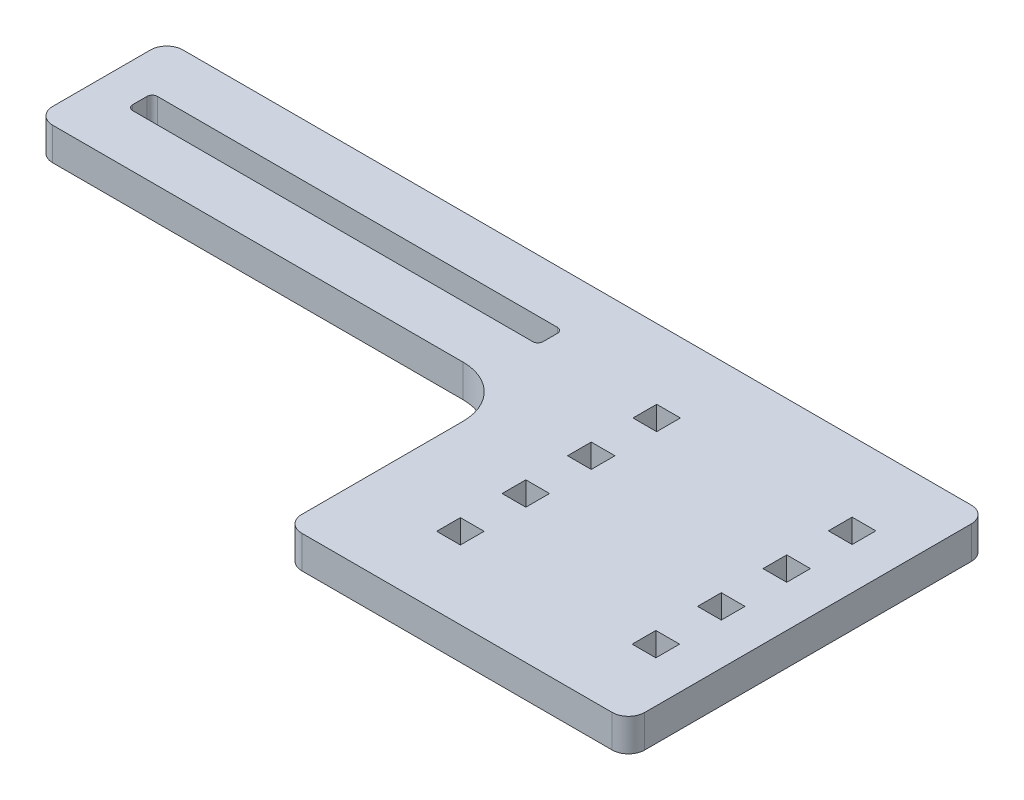
from build123d import *

# Parameters (mm, degrees)
SKETCH1_W           = 80
SKETCH1_H           = 4.819787269
SKETCH1_W_2         = 4.6228
SKETCH1_H_2         = 4.6228
BOSS_EXTRUDE1_DEPTH = 6.35
FILLET2_R           = 3.175
FILLET3_R           = 3.175
FILLET4_R           = 10
FILLET5_R           = 1


with BuildPart() as part:
    # Sketch1 → Boss-Extrude1 (new body)
    with BuildSketch(Plane(origin=(0, 0, 0), x_dir=(1, 0, 0), z_dir=(0, 1, 0))):
        Polygon((0, 0), (160, 0), (160, -70), (93.1472, -70), (93.1472, -25.4), (0, -25.4), align=None)
        with Locations((47.5, -12.740106366)):
            Rectangle(SKETCH1_W, SKETCH1_H, mode=Mode.SUBTRACT)
        with Locations((149.5586, -15.96068286)):
            Rectangle(SKETCH1_W_2, SKETCH1_H_2, mode=Mode.SUBTRACT)
        with Locations((149.5586, -28.71348286)):
            Rectangle(SKETCH1_W_2, SKETCH1_H_2, mode=Mode.SUBTRACT)
        with Locations((149.5586, -41.46628286)):
            Rectangle(SKETCH1_W_2, SKETCH1_H_2, mode=Mode.SUBTRACT)
        with Locations((111.4586, -15.96068286)):
            Rectangle(SKETCH1_W_2, SKETCH1_H_2, mode=Mode.SUBTRACT)
        with Locations((111.4586, -28.71348286)):
            Rectangle(SKETCH1_W_2, SKETCH1_H_2, mode=Mode.SUBTRACT)
        with Locations((111.4586, -41.46628286)):
            Rectangle(SKETCH1_W_2, SKETCH1_H_2, mode=Mode.SUBTRACT)
        with Locations((149.5586, -54.21908286)):
            Rectangle(SKETCH1_W_2, SKETCH1_H_2, mode=Mode.SUBTRACT)
        with Locations((111.4586, -54.21908286)):
            Rectangle(SKETCH1_W_2, SKETCH1_H_2, mode=Mode.SUBTRACT)
    extrude(amount=BOSS_EXTRUDE1_DEPTH)

    # Fillet2
    fillet2_edges = [part.edges().sort_by_distance(p)[0] for p in [
        (0, 3.175, 25.4),
    ]]
    fillet(fillet2_edges, radius=FILLET2_R)

    # Fillet3
    fillet3_edges = [part.edges().sort_by_distance(p)[0] for p in [
        (0, 3.175, 0),
        (160, 3.175, 0),
        (160, 3.175, 70),
        (93.1472, 3.175, 70),
    ]]
    fillet(fillet3_edges, radius=FILLET3_R)

    # Fillet4
    fillet4_edges = [part.edges().sort_by_distance(p)[0] for p in [
        (93.1472, 3.175, 25.4),
    ]]
    fillet(fillet4_edges, radius=FILLET4_R)

    # Fillet5
    fillet5_edges = [part.edges().sort_by_distance(p)[0] for p in [
        (7.5, 3.175, 10.330212731),
        (7.5, 3.175, 15.15),
        (87.5, 3.175, 15.15),
        (87.5, 3.175, 10.330212731),
    ]]
    fillet(fillet5_edges, radius=FILLET5_R)


solid = part.part
